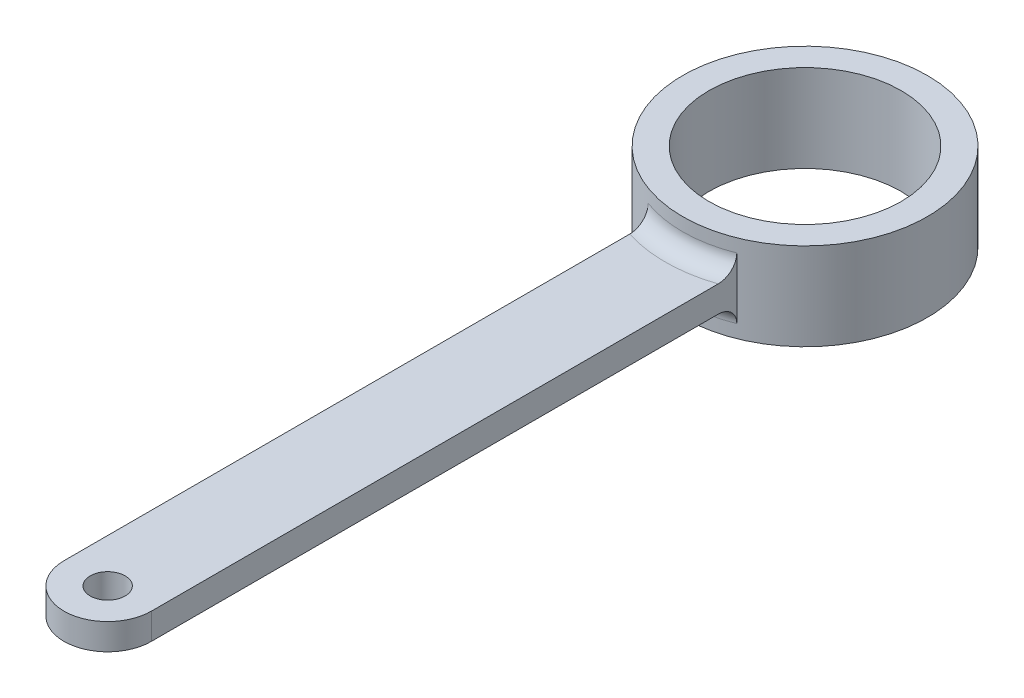
from build123d import *

# Parameters (mm, degrees)
SKETCH1_R           = 7
SKETCH1_R_2         = 5.5
BOSS_EXTRUDE1_DEPTH = 2.5
SKETCH2_R           = 1
BOSS_EXTRUDE2_DEPTH = 0.75
FILLET1_R           = 1


with BuildPart() as part:
    # Sketch1 → Boss-Extrude1 (new, symmetric)
    with BuildSketch(Plane(origin=(0, 0, 0), x_dir=(1, 0, 0), z_dir=(0, 1, 0))):
        with Locations(Location((0, 0, 0), (0, 0, 270))):
            Circle(SKETCH1_R)
        with Locations(Location((0, 0, 0), (0, 0, 270))):
            Circle(SKETCH1_R_2, mode=Mode.SUBTRACT)
    extrude(amount=BOSS_EXTRUDE1_DEPTH, both=True)

    # Sketch2 → Boss-Extrude2 (add, symmetric)
    with BuildSketch(Plane(origin=(0, 0, 0), x_dir=(1, 0, 0), z_dir=(0, 1, 0))):
        with BuildLine():
            Line((2.595653006, -40), (2.595653006, -6.500968041))
            ThreePointArc((2.595653006, -6.500968041), (0.102408357, -6.999250855), (-2.404346994, -6.574124697))
            Line((-2.404346994, -6.574124697), (-2.404346994, -40))
            ThreePointArc((-2.404346994, -40), (0.095653006, -42.5), (2.595653006, -40))
        make_face()
        with Locations(Location((0.095653006, -40, 0), (0, 0, 270))):
            Circle(SKETCH2_R, mode=Mode.SUBTRACT)
    extrude(amount=BOSS_EXTRUDE2_DEPTH, both=True)

    # Fillet1
    fillet1_edges = [part.edges().sort_by_distance(p)[0] for p in [
        (1.321594437, 0.75, 6.874109989),
        (1.321594437, -0.75, 6.874109989),
    ]]
    fillet(fillet1_edges, radius=FILLET1_R)


solid = part.part
